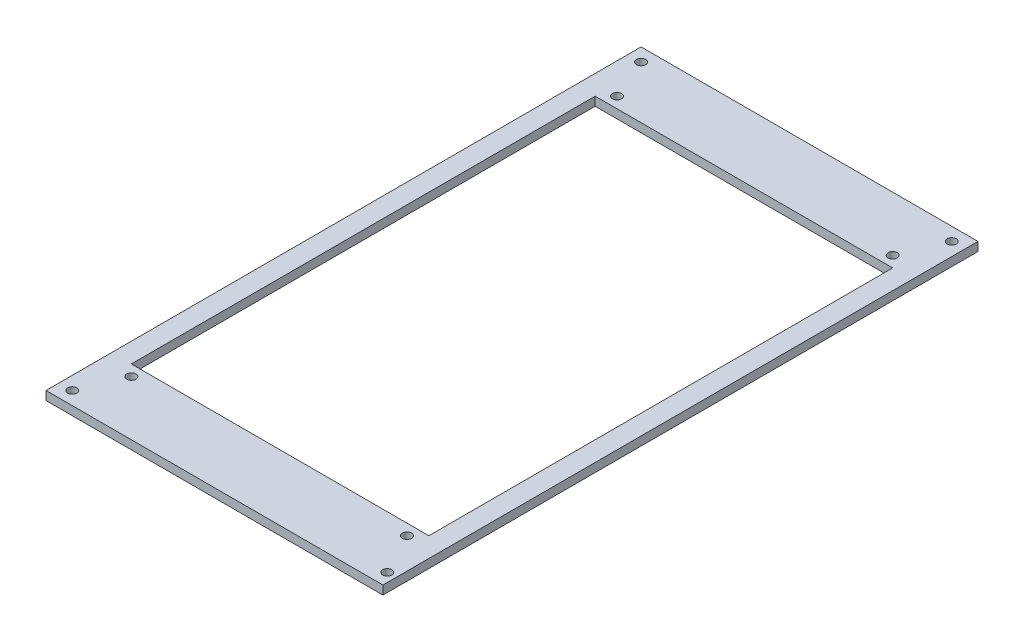
from build123d import *

# Parameters (mm, degrees)
SKETCH_2_W      = 77
SKETCH_2_H      = 136
SKETCH_2_R      = 1.05
SKETCH_2_W_2    = 68
SKETCH_2_H_2    = 106
EXTRUDE_1_DEPTH = 2


with BuildPart() as part:
    # 草图2 → 凸台-拉伸1 (new body)
    with BuildSketch(Plane(origin=(0, 0, 0), x_dir=(1, 0, 0), z_dir=(0, 1, 0))):
        with Locations((38.5, -68)):
            Rectangle(SKETCH_2_W, SKETCH_2_H)
        with Locations(Location((3, -3, 0), (0, 0, 270))):
            Circle(SKETCH_2_R, mode=Mode.SUBTRACT)
        with Locations(Location((74, -3, 0), (0, 0, 270))):
            Circle(SKETCH_2_R, mode=Mode.SUBTRACT)
        with Locations(Location((3, -133, 0), (0, 0, 270))):
            Circle(SKETCH_2_R, mode=Mode.SUBTRACT)
        with Locations(Location((75, -133, 0), (0, 0, 270))):
            Circle(SKETCH_2_R, mode=Mode.SUBTRACT)
        with Locations(Location((7, -12.5, 0), (0, 0, 270))):
            Circle(SKETCH_2_R, mode=Mode.SUBTRACT)
        with Locations(Location((70, -12.5, 0), (0, 0, 270))):
            Circle(SKETCH_2_R, mode=Mode.SUBTRACT)
        with Locations(Location((70, -123.5, 0), (0, 0, 270))):
            Circle(SKETCH_2_R, mode=Mode.SUBTRACT)
        with Locations(Location((7, -123.5, 0), (0, 0, 270))):
            Circle(SKETCH_2_R, mode=Mode.SUBTRACT)
        with Locations((38.5, -68)):
            Rectangle(SKETCH_2_W_2, SKETCH_2_H_2, mode=Mode.SUBTRACT)
    extrude(amount=EXTRUDE_1_DEPTH)


solid = part.part
